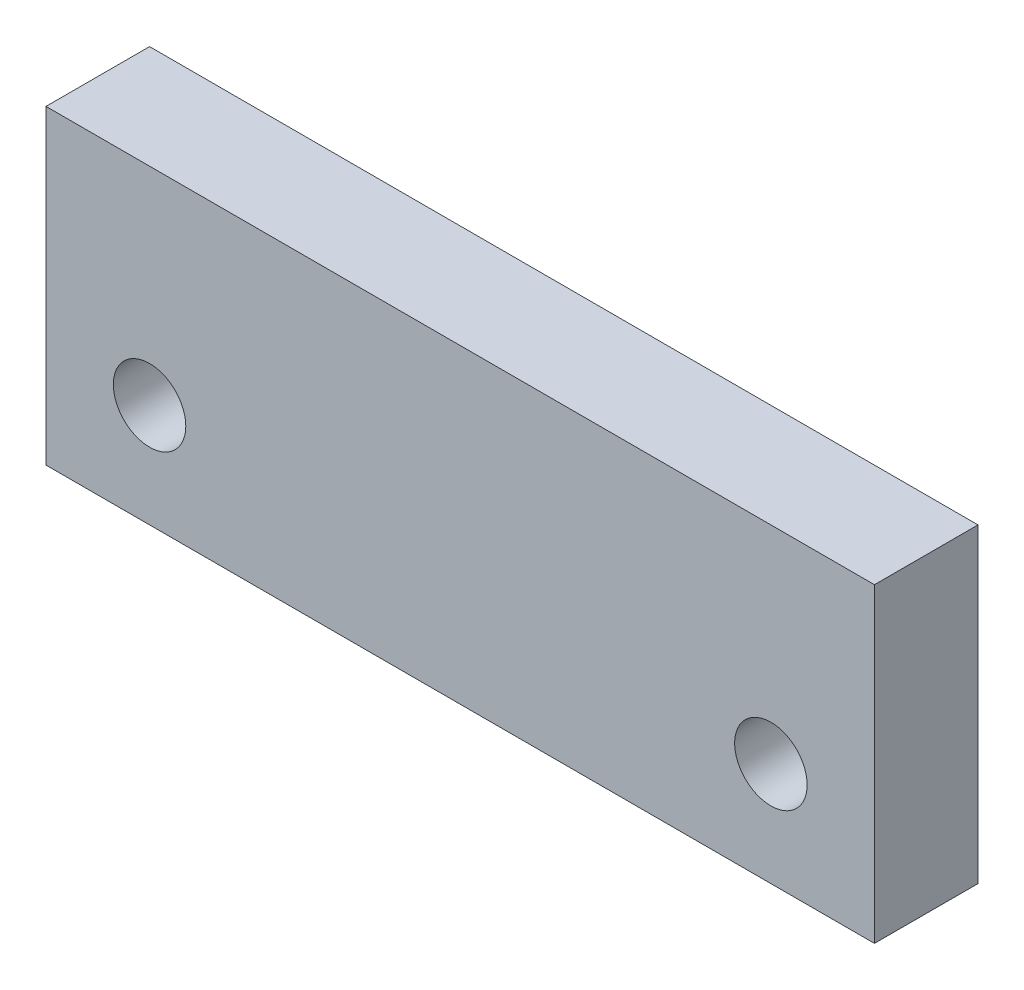
from build123d import *

# Parameters (mm, degrees)
SZKIC1_W                    = 40
SZKIC1_H                    = 15
SZKIC1_R                    = 1.75
DODANIE_WYCI_GNI_CIE1_DEPTH = 5


with BuildPart() as part:
    # Szkic1 → Dodanie-wyciągnięcie1 (new body)
    with BuildSketch(Plane.XY):
        Rectangle(SZKIC1_W, SZKIC1_H)
        with Locations((-15, -2.5)):
            Circle(SZKIC1_R, mode=Mode.SUBTRACT)
        with Locations((15, -2.5)):
            Circle(SZKIC1_R, mode=Mode.SUBTRACT)
    extrude(amount=DODANIE_WYCI_GNI_CIE1_DEPTH)


solid = part.part
